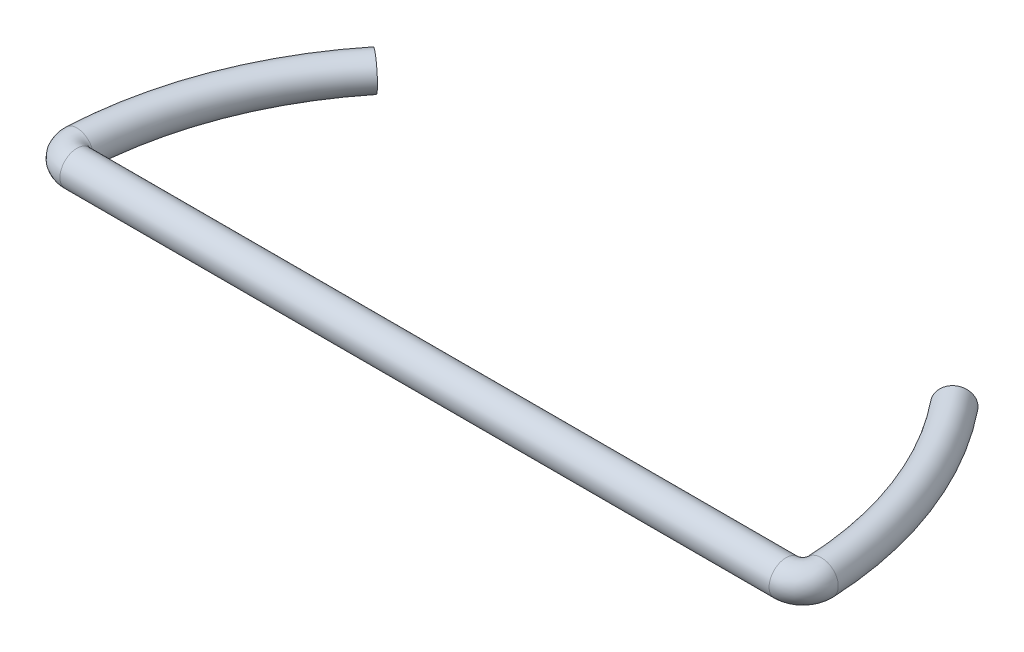
from build123d import *

# Parameters (mm, degrees)
SKETCH2_R = 1.5


with BuildPart() as part:
    # Sweep1: sweep along a path in Sketch1
    with BuildLine(Plane(origin=(0, 0, 0), x_dir=(1, 0, 0), z_dir=(0, 1, 0))) as sweep1_path:
        Line((0, 0), (-31.464265445, 0))
        ThreePointArc((-31.464265445, 0), (-32.549885742, 0.464901661), (-32.9625638, 1.571428571))
        ThreePointArc((-32.9625638, 1.571428571), (-30.85373786, 11.706701501), (-25.708527179, 20.689891984))
    # Sketch2 → Sweep1 (sweep)
    with BuildSketch(Plane(origin=(0, 0, 0), x_dir=(0, 0, -1), z_dir=(1, 0, 0))):
        Circle(SKETCH2_R)
    sweep1 = sweep(path=sweep1_path.line)

    # Mirror1: Sweep1 across plane
    add(sweep1.mirror(Plane(origin=(0, 0, 0), x_dir=(0, 0, 1), z_dir=(1, 0, 0))))


solid = part.part
